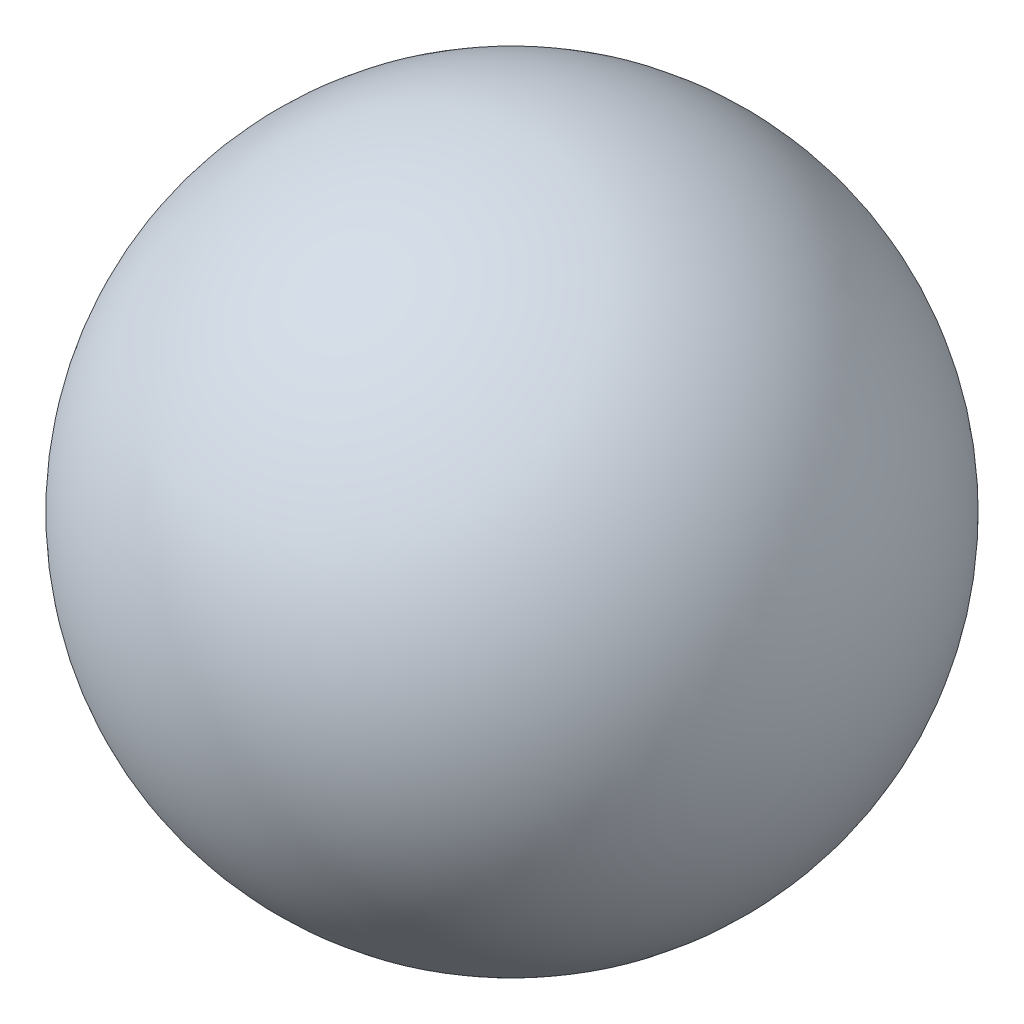
from build123d import *


with BuildPart() as part:
    # Sketch1 → Revolve1 (revolve)
    with BuildSketch(Plane(origin=(0, 0, 0), x_dir=(0, 0, -1), z_dir=(1, 0, 0))):
        with BuildLine():
            Line((0, 1.75), (0, -1.75))
            ThreePointArc((0, -1.75), (-1.75, 0), (0, 1.75))
        make_face()
    revolve(axis=Axis((0, 1.75, 0), (0, -1, 0)))


solid = part.part
